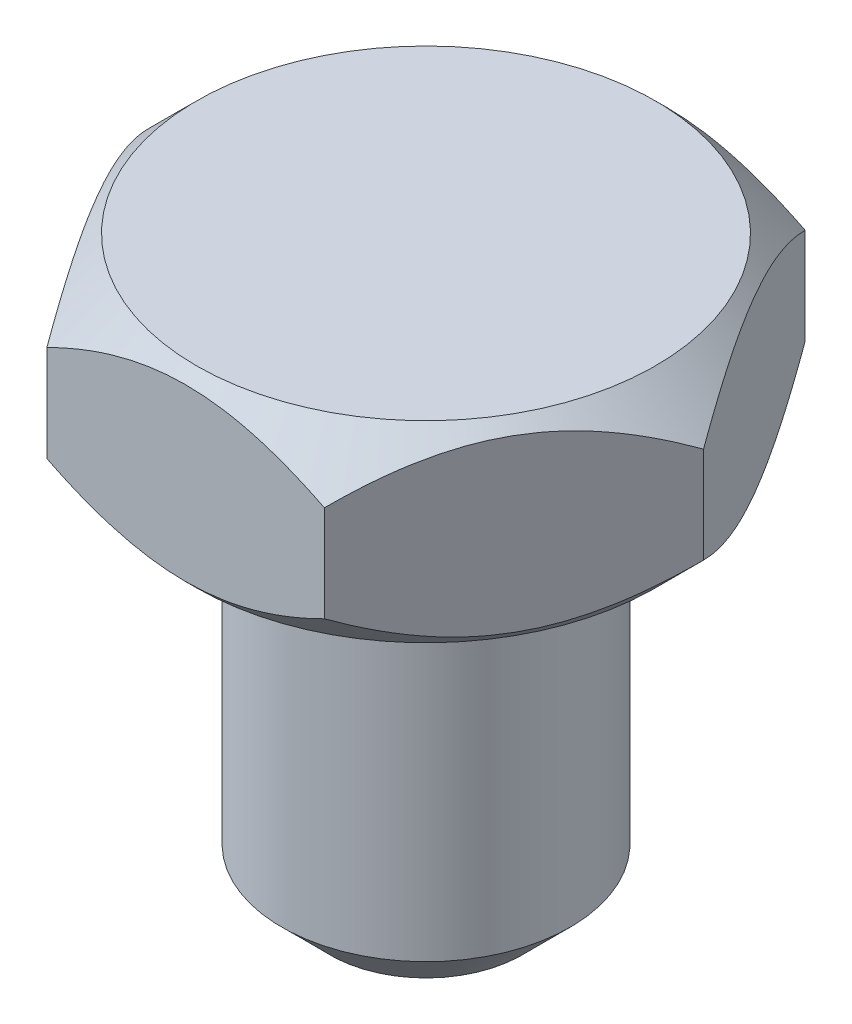
from build123d import *

# Parameters (mm, degrees)
EXTRUDE_1_DEPTH = 4
SKETCH_2_R      = 3
EXTRUDE_2_DEPTH = 8
CHAMFER_2_SIZE  = 1


with BuildPart() as part:
    # Эскиз1 → Вытянуть1 (new body)
    with BuildSketch(Plane(origin=(0, 0, 0), x_dir=(1, 0, 0), z_dir=(0, 1, 0))):
        Polygon((-2.886751346, 5), (2.886751346, 5), (5.773502692, 0), (2.886751346, -5), (-2.886751346, -5), (-5.773502692, 0), align=None)
    extrude(amount=-EXTRUDE_1_DEPTH)

    # Эскиз2 → Вытянуть2 (add)
    with BuildSketch(Plane.XZ.offset(4)):
        with Locations(Location((0, 0, 0), (0, 0, 270))):
            Circle(SKETCH_2_R)
    extrude(amount=EXTRUDE_2_DEPTH)

    # Фаска2
    chamfer_2_edges = [part.edges().sort_by_distance(p)[0] for p in [
        (0, -12, 3),
    ]]
    chamfer(chamfer_2_edges, length=CHAMFER_2_SIZE)

    # Эскиз3 → Вырез-Повернуть1 (revolve, cut)
    with BuildSketch(Plane.XY, mode=Mode.PRIVATE) as cut_revolve_1_sk:
        Polygon((-5.773502692, -1), (-4.773502692, 0), (-5.773502692, 0), align=None)
        Polygon((-5.773502692, -3), (-4.773502692, -4), (-5.773502692, -4), align=None)
    revolve(cut_revolve_1_sk.sketch.rotate(Axis((0, -4, 0), (0, -1, 0)), 270), axis=Axis((0, -4, 0), (0, -1, 0)), mode=Mode.SUBTRACT)


solid = part.part
